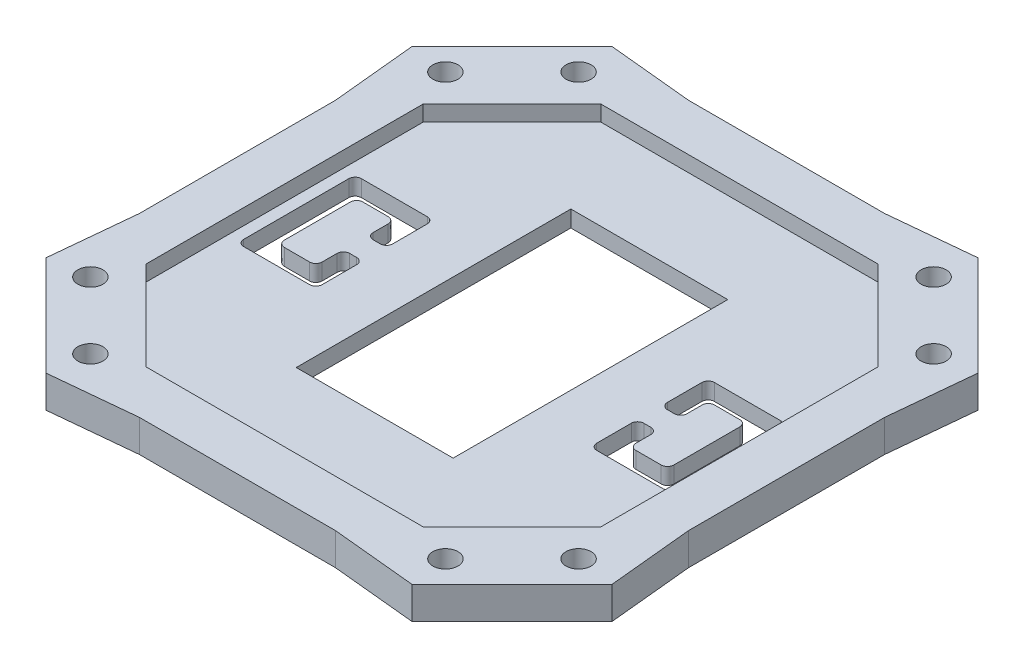
from build123d import *

# Parameters (mm, degrees)
SKETCH1_R           = 1.6
BOSS_EXTRUDE1_DEPTH = 4.1
CUT_EXTRUDE1_DEPTH  = 2
CUT_EXTRUDE2_DEPTH  = 52.043042311
SKETCH4_W           = 20
SKETCH4_H           = 35
CUT_EXTRUDE3_DEPTH  = 52.043042311


with BuildPart() as part:
    # Sketch1 → Boss-Extrude1 (new body)
    with BuildSketch(Plane(origin=(0, 0, 0), x_dir=(1, 0, 0), z_dir=(0, 1, 0))):
        Polygon((-35, 12.5), (-36.062322224, 23.334400163), (-23.334400163, 36.062322224), (-12.5, 35), (12.5, 35), (23.334400163, 36.062322224), (36.062322224, 23.334400163), (35, 12.5), (35, -12.5), (36.062322224, -23.334400163), (23.334400163, -36.062322224), (12.5, -35), (-12.5, -35), (-23.334400163, -36.062322224), (-36.062322224, -23.334400163), (-35, -12.5), align=None)
        with Locations(Location((22.627293382, 31.112574756, 0), (0, 0, 270))):
            Circle(SKETCH1_R, mode=Mode.SUBTRACT)
        with Locations(Location((31.112574756, 22.627293382, 0), (0, 0, 270))):
            Circle(SKETCH1_R, mode=Mode.SUBTRACT)
        with Locations(Location((31.112574756, -22.627293382, 0), (0, 0, 270))):
            Circle(SKETCH1_R, mode=Mode.SUBTRACT)
        with Locations(Location((22.627293382, -31.112574756, 0), (0, 0, 270))):
            Circle(SKETCH1_R, mode=Mode.SUBTRACT)
        with Locations(Location((-22.627293382, -31.112574756, 0), (0, 0, 270))):
            Circle(SKETCH1_R, mode=Mode.SUBTRACT)
        with Locations(Location((-31.112574756, -22.627293382, 0), (0, 0, 270))):
            Circle(SKETCH1_R, mode=Mode.SUBTRACT)
        with Locations(Location((-31.112574756, 22.627293382, 0), (0, 0, 270))):
            Circle(SKETCH1_R, mode=Mode.SUBTRACT)
        with Locations(Location((-22.627293382, 31.112574756, 0), (0, 0, 270))):
            Circle(SKETCH1_R, mode=Mode.SUBTRACT)
    extrude(amount=BOSS_EXTRUDE1_DEPTH)

    # Sketch2 → Cut-Extrude1 (cut)
    with BuildSketch(Plane(origin=(0, 4.1, 0), x_dir=(1, 0, 0), z_dir=(0, 1, 0))):
        Polygon((-17.668800325, 29), (17.668800325, 29), (29, 17.668800325), (29, -17.668800325), (17.668800325, -29), (-17.668800325, -29), (-29, -17.668800325), (-29, 17.668800325), align=None)
    extrude(amount=-CUT_EXTRUDE1_DEPTH, mode=Mode.SUBTRACT)

    # Sketch3 → Cut-Extrude2 (cut, through all)
    with BuildSketch(Plane(origin=(0, 2.1, 0), x_dir=(1, 0, 0), z_dir=(0, 1, 0))):
        with BuildLine():
            Line((-27.5, 6.7), (-27.5, -6.7))
            ThreePointArc((-27.5, -6.7), (-27.265685425, -7.265685425), (-26.7, -7.5))
            Line((-26.7, -7.5), (-18.3, -7.5))
            ThreePointArc((-18.3, -7.5), (-17.734314575, -7.265685425), (-17.5, -6.7))
            Line((-17.5, -6.7), (-17.5, -2.3))
            ThreePointArc((-17.5, -2.3), (-17.734314575, -1.734314575), (-18.3, -1.5))
            Line((-18.3, -1.5), (-19.2, -1.5))
            ThreePointArc((-19.2, -1.5), (-19.765685425, -1.734314575), (-20, -2.3))
            Line((-20, -2.3), (-20, -4.2))
            ThreePointArc((-20, -4.2), (-20.234314575, -4.765685425), (-20.8, -5))
            Line((-20.8, -5), (-24.02, -5))
            ThreePointArc((-24.02, -5), (-24.585685425, -4.765685425), (-24.82, -4.2))
            Line((-24.82, -4.2), (-24.82, 4.22))
            ThreePointArc((-24.82, 4.22), (-24.585685425, 4.785685425), (-24.02, 5.02))
            Line((-24.02, 5.02), (-20.8, 5.02))
            ThreePointArc((-20.8, 5.02), (-20.234314575, 4.785685425), (-20, 4.22))
            Line((-20, 4.22), (-20, 2.3))
            ThreePointArc((-20, 2.3), (-19.765685425, 1.734314575), (-19.2, 1.5))
            Line((-19.2, 1.5), (-18.3, 1.5))
            ThreePointArc((-18.3, 1.5), (-17.734314575, 1.734314575), (-17.5, 2.3))
            Line((-17.5, 2.3), (-17.5, 6.7))
            ThreePointArc((-17.5, 6.7), (-17.734314575, 7.265685425), (-18.3, 7.5))
            Line((-18.3, 7.5), (-26.7, 7.5))
            ThreePointArc((-26.7, 7.5), (-27.265685425, 7.265685425), (-27.5, 6.7))
        make_face()
        with BuildLine():
            Line((18.3, 7.5), (26.7, 7.5))
            ThreePointArc((26.7, 7.5), (27.265685425, 7.265685425), (27.5, 6.7))
            Line((27.5, 6.7), (27.5, -6.7))
            ThreePointArc((27.5, -6.7), (27.265685425, -7.265685425), (26.7, -7.5))
            Line((26.7, -7.5), (18.3, -7.5))
            ThreePointArc((18.3, -7.5), (17.734314575, -7.265685425), (17.5, -6.7))
            Line((17.5, -6.7), (17.5, -2.3))
            ThreePointArc((17.5, -2.3), (17.734314575, -1.734314575), (18.3, -1.5))
            Line((18.3, -1.5), (19.2, -1.5))
            ThreePointArc((19.2, -1.5), (19.765685425, -1.734314575), (20, -2.3))
            Line((20, -2.3), (20, -4.2))
            ThreePointArc((20, -4.2), (20.234314575, -4.765685425), (20.8, -5))
            Line((20.8, -5), (24.02, -5))
            ThreePointArc((24.02, -5), (24.585685425, -4.765685425), (24.82, -4.2))
            Line((24.82, -4.2), (24.82, 4.22))
            ThreePointArc((24.82, 4.22), (24.585685425, 4.785685425), (24.02, 5.02))
            Line((24.02, 5.02), (20.8, 5.02))
            ThreePointArc((20.8, 5.02), (20.234314575, 4.785685425), (20, 4.22))
            Line((20, 4.22), (20, 2.3))
            ThreePointArc((20, 2.3), (19.765685425, 1.734314575), (19.2, 1.5))
            Line((19.2, 1.5), (18.3, 1.5))
            ThreePointArc((18.3, 1.5), (17.734314575, 1.734314575), (17.5, 2.3))
            Line((17.5, 2.3), (17.5, 6.7))
            ThreePointArc((17.5, 6.7), (17.734314575, 7.265685425), (18.3, 7.5))
        make_face()
    extrude(amount=-CUT_EXTRUDE2_DEPTH, mode=Mode.SUBTRACT)

    # Sketch4 → Cut-Extrude3 (cut, through all)
    with BuildSketch(Plane(origin=(0, 2.1, 0), x_dir=(1, 0, 0), z_dir=(0, 1, 0))):
        Rectangle(SKETCH4_W, SKETCH4_H)
    extrude(amount=-CUT_EXTRUDE3_DEPTH, mode=Mode.SUBTRACT)


solid = part.part
